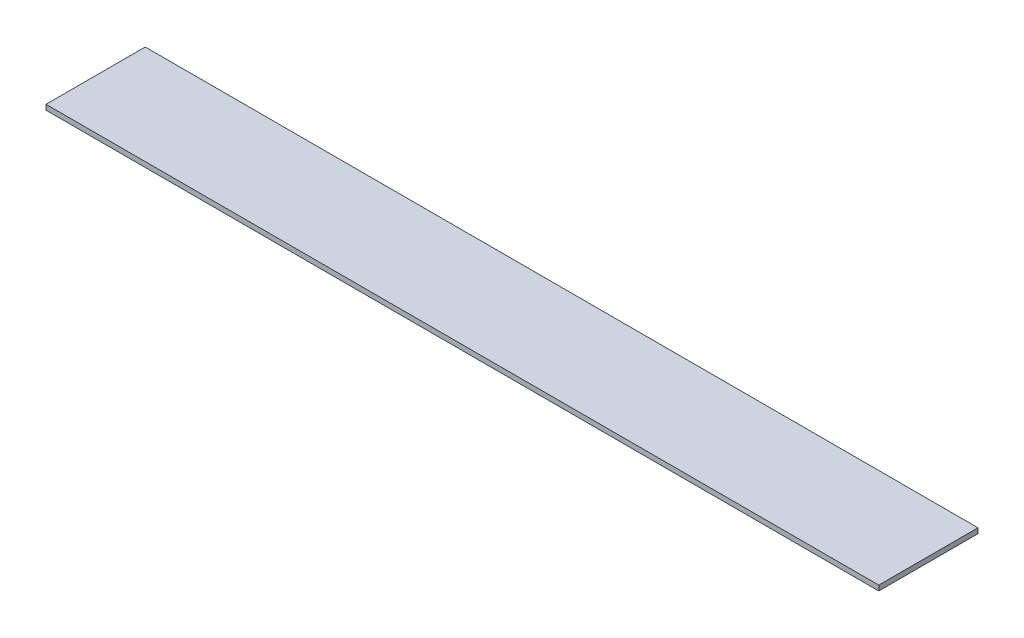
from build123d import *

# Parameters (mm, degrees)
SKIZZE1_W                       = 5035
SKIZZE1_H                       = 600
AUFSATZ_LINEAR_AUSTRAGEN1_DEPTH = 31


with BuildPart() as part:
    # Skizze1 → Aufsatz-Linear austragen1 (new body)
    with BuildSketch(Plane(origin=(0, 0, 0), x_dir=(1, 0, 0), z_dir=(0, 1, 0))):
        with Locations((2517.5, 300)):
            Rectangle(SKIZZE1_W, SKIZZE1_H)
    extrude(amount=AUFSATZ_LINEAR_AUSTRAGEN1_DEPTH)


solid = part.part
